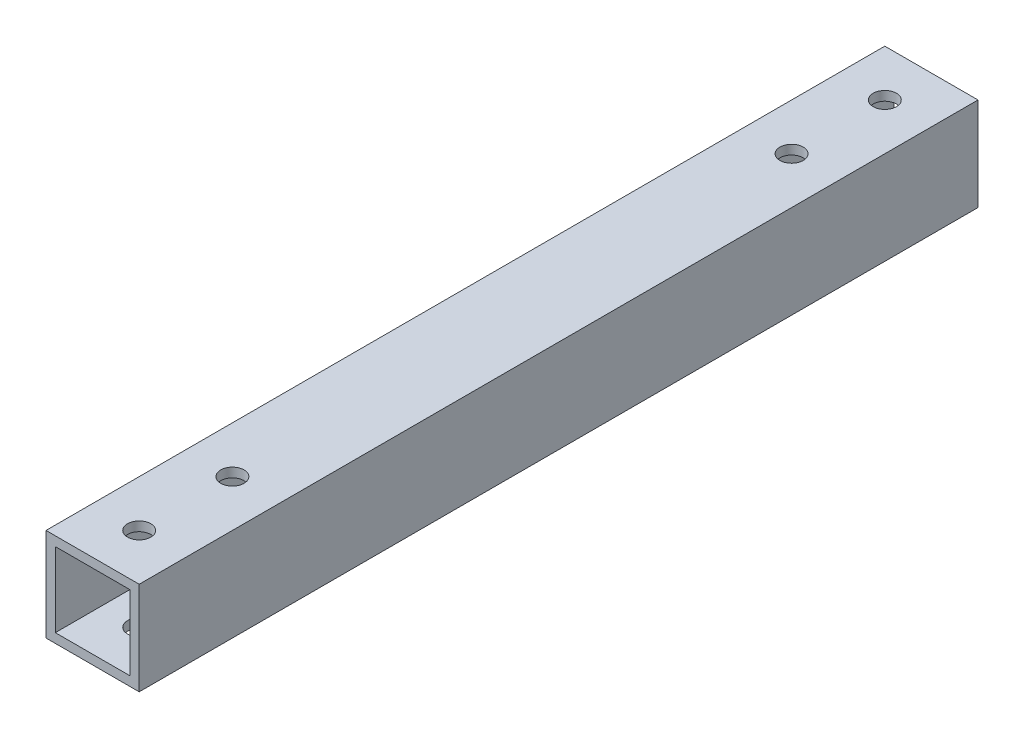
from build123d import *

# Parameters (mm, degrees)
SKETCH1_W           = 20
SKETCH1_H           = 20
SKETCH1_W_2         = 16
SKETCH1_H_2         = 16
BOSS_EXTRUDE1_DEPTH = 180
SKETCH2_R           = 2.5
CUT_EXTRUDE1_DEPTH  = 182.383571472


with BuildPart() as part:
    # Sketch1 → Boss-Extrude1 (new body)
    with BuildSketch(Plane.XY):
        Rectangle(SKETCH1_W, SKETCH1_H)
        Rectangle(SKETCH1_W_2, SKETCH1_H_2, mode=Mode.SUBTRACT)
    extrude(amount=BOSS_EXTRUDE1_DEPTH)

    # Sketch2 → Cut-Extrude1 (cut, through all)
    with BuildSketch(Plane(origin=(0, 10, 0), x_dir=(1, 0, 0), z_dir=(0, 1, 0))):
        with Locations(Location((0, -10, 0), (0, 0, 180))):
            Circle(SKETCH2_R)
        with Locations(Location((0, -30, 0), (0, 0, 180))):
            Circle(SKETCH2_R)
        with Locations(Location((0, -150, 0), (0, 0, 270))):
            Circle(SKETCH2_R)
        with Locations(Location((0, -170, 0), (0, 0, 270))):
            Circle(SKETCH2_R)
    extrude(amount=-CUT_EXTRUDE1_DEPTH, mode=Mode.SUBTRACT)


solid = part.part
